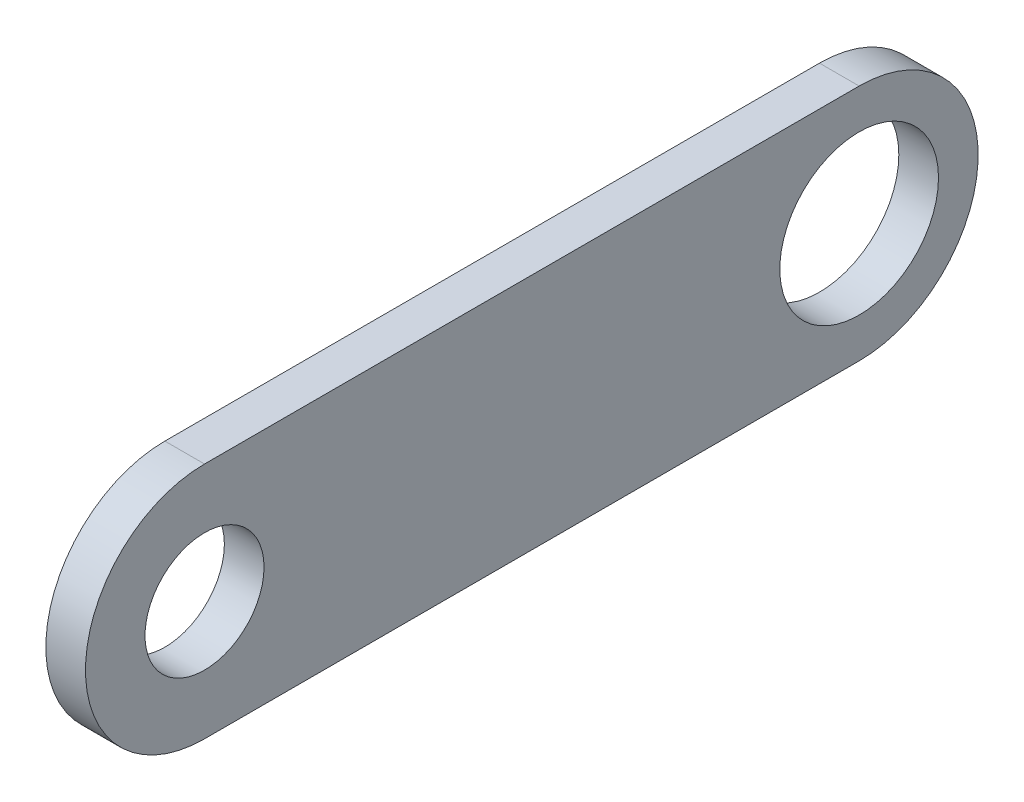
from build123d import *

# Parameters (mm, degrees)
SKETCH_1_R      = 3
SKETCH_1_R_2    = 4
EXTRUDE_1_DEPTH = 2


with BuildPart() as part:
    # ｽｹｯﾁ1 → ﾎﾞｽ - 押し出し1 (new body)
    with BuildSketch(Plane(origin=(0, 0, 0), x_dir=(0, -1, 0), z_dir=(-1, 0, 0))):
        with BuildLine():
            Line((6, -33), (6, 0))
            ThreePointArc((6, 0), (0, 6), (-6, 0))
            Line((-6, 0), (-6, -33))
            ThreePointArc((-6, -33), (0, -39), (6, -33))
        make_face()
        with Locations(Location((0, 0, 0), (0, 0, 270))):
            Circle(SKETCH_1_R, mode=Mode.SUBTRACT)
        with Locations(Location((0, -33, 0), (0, 0, 270))):
            Circle(SKETCH_1_R_2, mode=Mode.SUBTRACT)
    extrude(amount=-EXTRUDE_1_DEPTH)


solid = part.part
